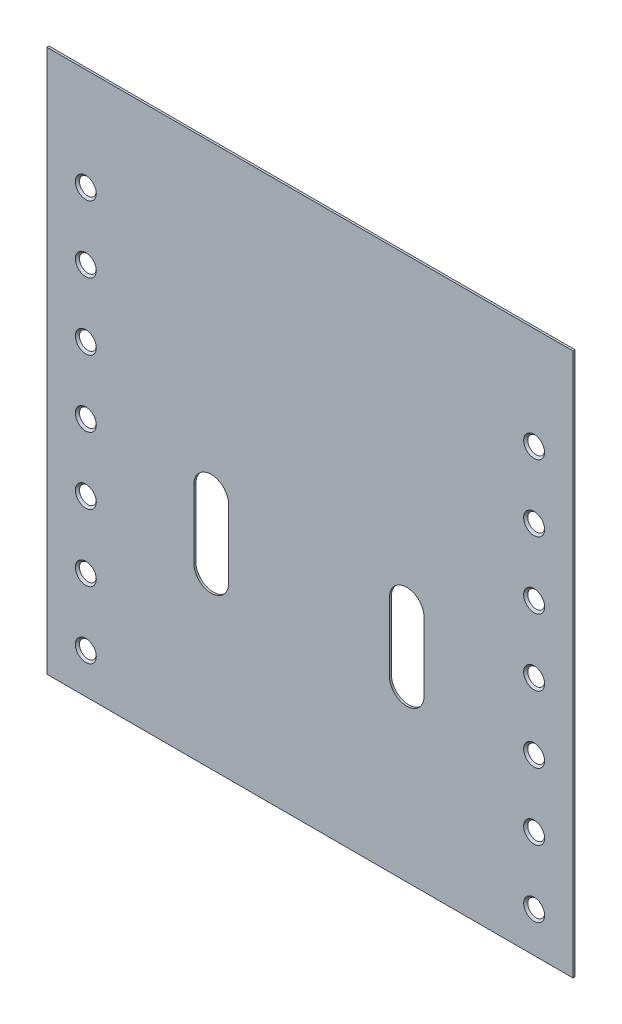
from build123d import *

# Parameters (mm, degrees)
SKETCH1_W                                      = 196.85
SKETCH1_H                                      = 203.2
BOSS_EXTRUDE1_DEPTH                            = 0.7747
CUT_EXTRUDE7_DEPTH                             = 313.185586086
SKETCH4_W                                      = 196.85
SKETCH4_H                                      = 0.6096
BOSS_EXTRUDE2_DEPTH                            = 12
SKETCH14_W                                     = 196.85
SKETCH14_H                                     = 11.938
BOSS_EXTRUDE3_DEPTH                            = 0.7747
SKETCH13_W                                     = 196.85
SKETCH13_H                                     = 0.6096
CUT_EXTRUDE9_DEPTH                             = 12
CSK_FOR_M3_FLAT_HEAD_MACHINE_SCREW3_AT_2_COUNT = 2
CSK_FOR_M3_FLAT_HEAD_MACHINE_SCREW3_AT_2_PITCH = 150
CSK_FOR_M3_FLAT_HEAD_MACHINE_SCREW3_AT_3_COUNT = 2
CSK_FOR_M3_FLAT_HEAD_MACHINE_SCREW3_AT_3_PITCH = 125
CSK_FOR_M3_FLAT_HEAD_MACHINE_SCREW3_AT_4_COUNT = 2
CSK_FOR_M3_FLAT_HEAD_MACHINE_SCREW3_AT_4_PITCH = 100
CSK_FOR_M3_FLAT_HEAD_MACHINE_SCREW3_AT_5_COUNT = 2
CSK_FOR_M3_FLAT_HEAD_MACHINE_SCREW3_AT_5_PITCH = 75
CSK_FOR_M3_FLAT_HEAD_MACHINE_SCREW3_AT_6_COUNT = 2
CSK_FOR_M3_FLAT_HEAD_MACHINE_SCREW3_AT_6_PITCH = 50
CSK_FOR_M3_FLAT_HEAD_MACHINE_SCREW3_AT_7_COUNT = 2
CSK_FOR_M3_FLAT_HEAD_MACHINE_SCREW3_AT_7_PITCH = 25


with BuildPart() as part:
    # Sketch1 → Boss-Extrude1 (new body)
    with BuildSketch(Plane(origin=(0, 0, 0), x_dir=(1, 0, 0), z_dir=(0, 0, -1))):
        with Locations((-104.775, 135.4)):
            Rectangle(SKETCH1_W, SKETCH1_H)
    extrude(amount=BOSS_EXTRUDE1_DEPTH)

    # Sketch2 → Cut-Extrude7 (cut, through all)
    with BuildSketch(Plane(origin=(0, 0, -0.7747), x_dir=(1, 0, 0), z_dir=(0, 0, -1))):
        with BuildLine():
            Line((-135.221253236, 173.5), (-135.221253236, 148))
            ThreePointArc((-135.221253236, 148), (-141.721253236, 141.5), (-148.221253236, 148))
            Line((-148.221253236, 148), (-148.221253236, 173.5))
            ThreePointArc((-148.221253236, 173.5), (-141.721253236, 180), (-135.221253236, 173.5))
        make_face()
        with BuildLine():
            Line((-62.069253236, 173.5), (-62.069253236, 148))
            ThreePointArc((-62.069253236, 148), (-68.569253236, 141.5), (-75.069253236, 148))
            Line((-75.069253236, 148), (-75.069253236, 173.5))
            ThreePointArc((-75.069253236, 173.5), (-68.569253236, 180), (-62.069253236, 173.5))
        make_face()
    extrude(amount=-CUT_EXTRUDE7_DEPTH, mode=Mode.SUBTRACT)

    # Sketch4 → Boss-Extrude2 (add)
    with BuildSketch(Plane.XY):
        with Locations((-104.775, -34.1048)):
            Rectangle(SKETCH4_W, SKETCH4_H)
    extrude(amount=BOSS_EXTRUDE2_DEPTH)

    # Sketch14 → Boss-Extrude3 (add)
    with BuildSketch(Plane.XY):
        with Locations((-104.775, -53.935004147)):
            Rectangle(SKETCH14_W, SKETCH14_H)
    extrude(amount=-BOSS_EXTRUDE3_DEPTH)

    # Sketch13 → Cut-Extrude9 (cut)
    with BuildSketch(Plane.XY.offset(12)):
        with Locations((-104.775, -34.1048)):
            Rectangle(SKETCH13_W, SKETCH13_H)
    extrude(amount=-CUT_EXTRUDE9_DEPTH, mode=Mode.SUBTRACT)

    # Sketch16 → CSK for M3 Flat Head Machine Screw3 (revolve, cut)
    with BuildSketch(Plane(origin=(-188.645, -72, 0), x_dir=(0, -1, 0), z_dir=(1, 0, 0))):
        Polygon((0, 0), (0, 0.7747), (1.7, 0.7747), (1.7, 2.212), (3.912, 0), align=None)
    csk_for_m3_flat_head_machine_screw3 = revolve(axis=Axis((-188.645, -72, 6.35), (0, 0, -1)), mode=Mode.SUBTRACT)

    # CSK for M3 Flat Head Machine Screw3 at 2: CSK for M3 Flat Head Machine Screw3 ×2
    with Locations(*[(0, -i * CSK_FOR_M3_FLAT_HEAD_MACHINE_SCREW3_AT_2_PITCH, 0) for i in range(1, CSK_FOR_M3_FLAT_HEAD_MACHINE_SCREW3_AT_2_COUNT)]):
        add(csk_for_m3_flat_head_machine_screw3, mode=Mode.SUBTRACT)

    # CSK for M3 Flat Head Machine Screw3 at 3: CSK for M3 Flat Head Machine Screw3 ×2
    with Locations(*[(0, -i * CSK_FOR_M3_FLAT_HEAD_MACHINE_SCREW3_AT_3_PITCH, 0) for i in range(1, CSK_FOR_M3_FLAT_HEAD_MACHINE_SCREW3_AT_3_COUNT)]):
        add(csk_for_m3_flat_head_machine_screw3, mode=Mode.SUBTRACT)

    # CSK for M3 Flat Head Machine Screw3 at 4: CSK for M3 Flat Head Machine Screw3 ×2
    with Locations(*[(0, -i * CSK_FOR_M3_FLAT_HEAD_MACHINE_SCREW3_AT_4_PITCH, 0) for i in range(1, CSK_FOR_M3_FLAT_HEAD_MACHINE_SCREW3_AT_4_COUNT)]):
        add(csk_for_m3_flat_head_machine_screw3, mode=Mode.SUBTRACT)

    # CSK for M3 Flat Head Machine Screw3 at 5: CSK for M3 Flat Head Machine Screw3 ×2
    with Locations(*[(0, -i * CSK_FOR_M3_FLAT_HEAD_MACHINE_SCREW3_AT_5_PITCH, 0) for i in range(1, CSK_FOR_M3_FLAT_HEAD_MACHINE_SCREW3_AT_5_COUNT)]):
        add(csk_for_m3_flat_head_machine_screw3, mode=Mode.SUBTRACT)

    # CSK for M3 Flat Head Machine Screw3 at 6: CSK for M3 Flat Head Machine Screw3 ×2
    with Locations(*[(0, -i * CSK_FOR_M3_FLAT_HEAD_MACHINE_SCREW3_AT_6_PITCH, 0) for i in range(1, CSK_FOR_M3_FLAT_HEAD_MACHINE_SCREW3_AT_6_COUNT)]):
        add(csk_for_m3_flat_head_machine_screw3, mode=Mode.SUBTRACT)

    # CSK for M3 Flat Head Machine Screw3 at 7: CSK for M3 Flat Head Machine Screw3 ×2
    with Locations(*[(0, -i * CSK_FOR_M3_FLAT_HEAD_MACHINE_SCREW3_AT_7_PITCH, 0) for i in range(1, CSK_FOR_M3_FLAT_HEAD_MACHINE_SCREW3_AT_7_COUNT)]):
        add(csk_for_m3_flat_head_machine_screw3, mode=Mode.SUBTRACT)

    # Mirror1: CSK for M3 Flat Head Machine Screw3 across plane
    add(csk_for_m3_flat_head_machine_screw3.mirror(Plane(origin=(-104.775, 0, 0), x_dir=(0, 0, 1), z_dir=(1, 0, 0))), mode=Mode.SUBTRACT)

    # Mirror1 copy 1 sketch → Mirror1 copy 1 (revolve, cut)
    with BuildSketch(Plane(origin=(-20.905, -222, 0), x_dir=(0, -1, 0), z_dir=(-1, 0, 0))):
        Polygon((0, 0), (0, -0.7747), (1.7, -0.7747), (1.7, -2.212), (3.912, 0), align=None)
    revolve(axis=Axis((-20.905, -222, 6.35), (0, 0, 1)), mode=Mode.SUBTRACT)

    # Mirror1 copy 2 sketch → Mirror1 copy 2 (revolve, cut)
    with BuildSketch(Plane(origin=(-20.905, -197, 0), x_dir=(0, -1, 0), z_dir=(-1, 0, 0))):
        Polygon((0, 0), (0, -0.7747), (1.7, -0.7747), (1.7, -2.212), (3.912, 0), align=None)
    revolve(axis=Axis((-20.905, -197, 6.35), (0, 0, 1)), mode=Mode.SUBTRACT)

    # Mirror1 copy 3 sketch → Mirror1 copy 3 (revolve, cut)
    with BuildSketch(Plane(origin=(-20.905, -172, 0), x_dir=(0, -1, 0), z_dir=(-1, 0, 0))):
        Polygon((0, 0), (0, -0.7747), (1.7, -0.7747), (1.7, -2.212), (3.912, 0), align=None)
    revolve(axis=Axis((-20.905, -172, 6.35), (0, 0, 1)), mode=Mode.SUBTRACT)

    # Mirror1 copy 4 sketch → Mirror1 copy 4 (revolve, cut)
    with BuildSketch(Plane(origin=(-20.905, -147, 0), x_dir=(0, -1, 0), z_dir=(-1, 0, 0))):
        Polygon((0, 0), (0, -0.7747), (1.7, -0.7747), (1.7, -2.212), (3.912, 0), align=None)
    revolve(axis=Axis((-20.905, -147, 6.35), (0, 0, 1)), mode=Mode.SUBTRACT)

    # Mirror1 copy 5 sketch → Mirror1 copy 5 (revolve, cut)
    with BuildSketch(Plane(origin=(-20.905, -122, 0), x_dir=(0, -1, 0), z_dir=(-1, 0, 0))):
        Polygon((0, 0), (0, -0.7747), (1.7, -0.7747), (1.7, -2.212), (3.912, 0), align=None)
    revolve(axis=Axis((-20.905, -122, 6.35), (0, 0, 1)), mode=Mode.SUBTRACT)

    # Mirror1 copy 6 sketch → Mirror1 copy 6 (revolve, cut)
    with BuildSketch(Plane(origin=(-20.905, -97, 0), x_dir=(0, -1, 0), z_dir=(-1, 0, 0))):
        Polygon((0, 0), (0, -0.7747), (1.7, -0.7747), (1.7, -2.212), (3.912, 0), align=None)
    revolve(axis=Axis((-20.905, -97, 6.35), (0, 0, 1)), mode=Mode.SUBTRACT)


solid = part.part
